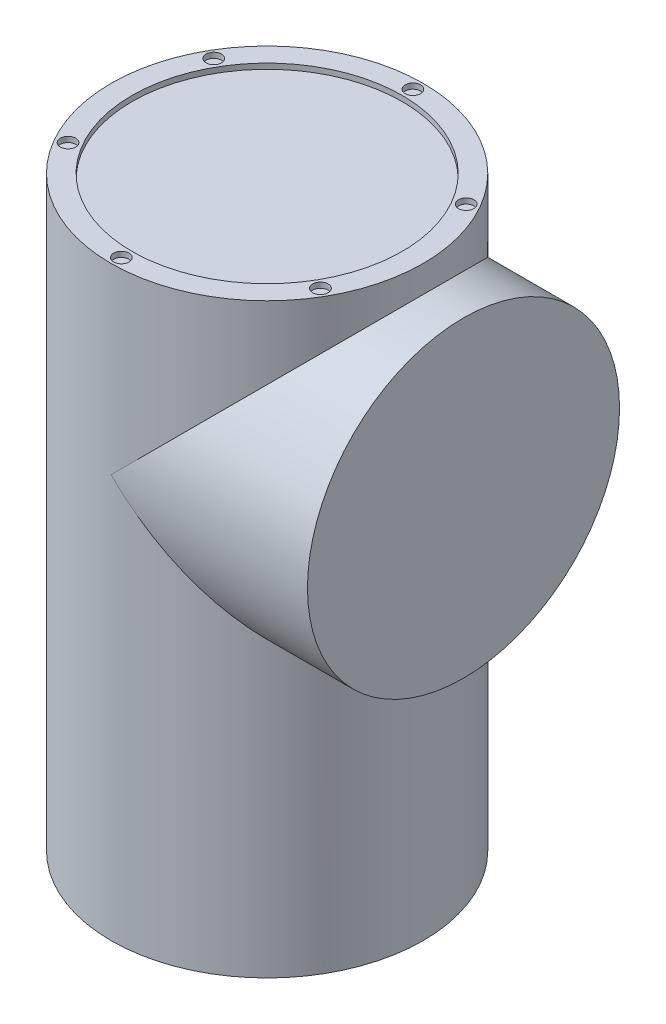
from build123d import *

# Parameters (mm, degrees)
CORTAR_EXTRUIR4_DEPTH      = 312.012057644
SALIENTE_EXTRUIR1_START    = -30
CROQUIS4_R                 = 67.5
SALIENTE_EXTRUIR1_DEPTH    = 30
SALIENTE_EXTRUIR2_START    = 2
CROQUIS5_R                 = 58
CROQUIS5_R_2               = 50.227847336
CROQUIS5_R_3               = 2.860878396
SALIENTE_EXTRUIR2_DEPTH    = 2
CROQUIS6_R                 = 58
SALIENTE_EXTRUIR3_DEPTH    = 73
CORTAR_EXTRUIR5_DEPTH      = 315.148452169
CORTAR_EXTRUIR5_DEPTH_BACK = 315.148452169
CROQUIS7_W                 = 212.825411986
CROQUIS7_H                 = 84.990442804


with BuildPart() as part:
    # Croquis2 → Revolución1 (revolve)
    with BuildSketch(Plane.XY):
        Polygon((0, 0), (-67.5, 0), (-67.5, 26.689315597), (-58, 80), (-58, 296), (0, 296), align=None)
    revolve(axis=Axis((0, 296, 0), (0, -1, 0)))

    # Croquis3 → Cortar-Extruir4 (cut, through all)
    with BuildSketch(Plane(origin=(0, 296, 0), x_dir=(1, 0, 0), z_dir=(0, 1, 0))):
        Polygon((0, 58), (-8.909431544, 66.909431544), (8.909431544, 66.909431544), align=None)
        Polygon((66.909431544, -8.909431544), (58, 0), (66.909431544, 8.909431544), align=None)
        Polygon((-8.909431544, -66.909431544), (0, -58), (8.909431544, -66.909431544), align=None)
        Polygon((-66.909431544, 8.909431544), (-58, 0), (-66.909431544, -8.909431544), align=None)
    extrude(amount=-CORTAR_EXTRUIR4_DEPTH, mode=Mode.SUBTRACT)

    # Croquis4 → Saliente-Extruir1 (add)
    with BuildSketch(Plane.XZ.offset(SALIENTE_EXTRUIR1_START)):
        with Locations(Location((0, 0, 0), (0, 0, 180))):
            Circle(CROQUIS4_R)
    extrude(amount=SALIENTE_EXTRUIR1_DEPTH)

    # Croquis5 → Saliente-Extruir2 (add)
    with BuildSketch(Plane(origin=(0, 296, 0), x_dir=(1, 0, 0), z_dir=(0, 1, 0)).offset(SALIENTE_EXTRUIR2_START)):
        with Locations(Location((0, 0, 0), (0, 0, 180))):
            Circle(CROQUIS5_R)
        with Locations(Location((0, 0, 0), (0, 0, 180))):
            Circle(CROQUIS5_R_2, mode=Mode.SUBTRACT)
        with Locations(Location((0, 54.172847051, 0), (0, 0, 180))):
            Circle(CROQUIS5_R_3, mode=Mode.SUBTRACT)
        with Locations(Location((46.915061741, 27.086423525, 0), (0, 0, 180))):
            Circle(CROQUIS5_R_3, mode=Mode.SUBTRACT)
        with Locations(Location((46.915061741, -27.086423525, 0), (0, 0, 180))):
            Circle(CROQUIS5_R_3, mode=Mode.SUBTRACT)
        with Locations(Location((0, -54.172847051, 0), (0, 0, 180))):
            Circle(CROQUIS5_R_3, mode=Mode.SUBTRACT)
        with Locations(Location((-46.915061741, -27.086423525, 0), (0, 0, 180))):
            Circle(CROQUIS5_R_3, mode=Mode.SUBTRACT)
        with Locations(Location((-46.915061741, 27.086423525, 0), (0, 0, 180))):
            Circle(CROQUIS5_R_3, mode=Mode.SUBTRACT)
    extrude(amount=-SALIENTE_EXTRUIR2_DEPTH)

    # Croquis6 → Saliente-Extruir3 (add)
    with BuildSketch(Plane(origin=(0, 0, 0), x_dir=(0, 0, -1), z_dir=(1, 0, 0))):
        with Locations((0, 230)):
            Circle(CROQUIS6_R)
    extrude(amount=SALIENTE_EXTRUIR3_DEPTH)

    # Croquis7 → Cortar-Extruir5 (cut, two sides: drawn at the far end of the back side and taken through both)
    with BuildSketch(Plane(origin=(0, 0, 0), x_dir=(0, 0, -1), z_dir=(1, 0, 0)).offset(-CORTAR_EXTRUIR5_DEPTH_BACK)):
        with Locations((5.734816491, 37.504778598)):
            Rectangle(CROQUIS7_W, CROQUIS7_H)
    extrude(amount=CORTAR_EXTRUIR5_DEPTH + CORTAR_EXTRUIR5_DEPTH_BACK, mode=Mode.SUBTRACT)


solid = part.part
